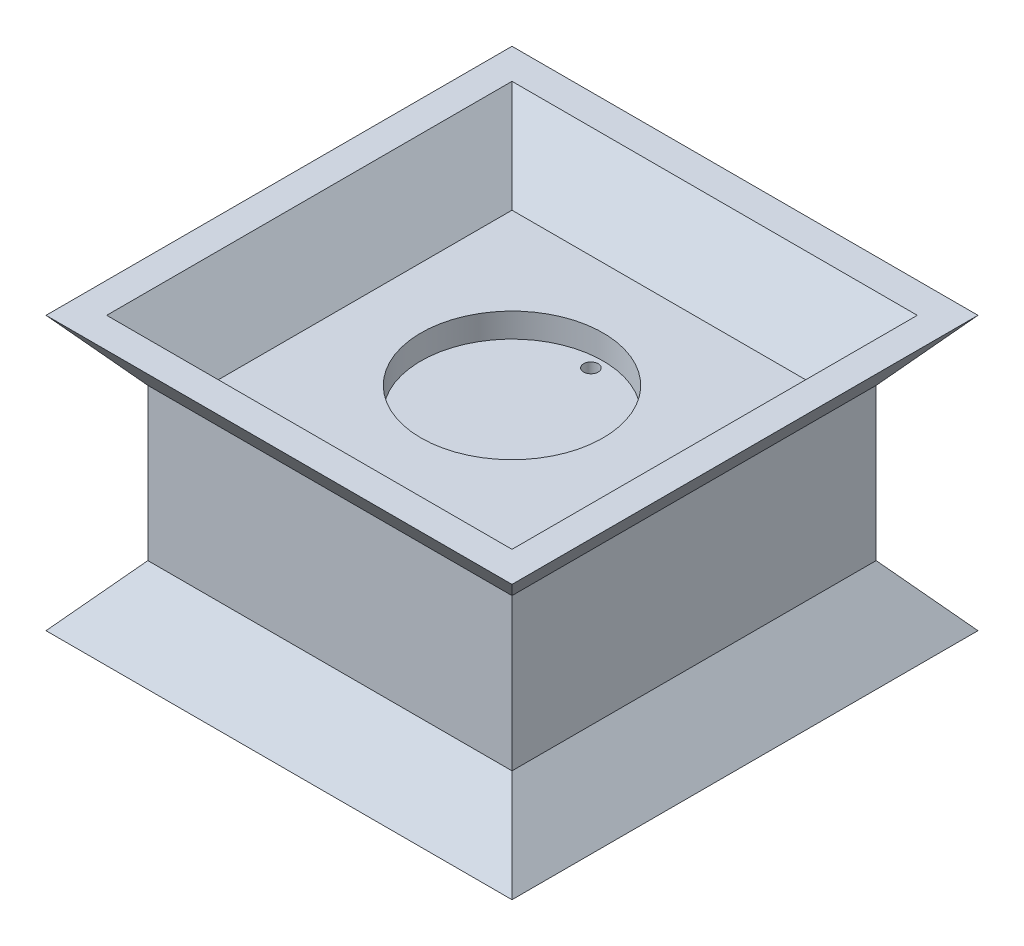
from build123d import *

# Parameters (mm, degrees)
SKETCH1_W               = 76.2
SKETCH1_H               = 76.2
BOSS_EXTRUDE1_DEPTH     = 15.875
SKETCH2_W               = 76.2
SKETCH2_H               = 76.2
BOSS_EXTRUDE2_DEPTH     = 12.7
BOSS_EXTRUDE2_DRAFT     = -40
MIRROR1_COPY_1_SKETCH_W = 76.2
MIRROR1_COPY_1_SKETCH_H = 76.2
MIRROR1_COPY_1_DEPTH    = 12.7
MIRROR1_COPY_1_DRAFT    = -40
SKETCH4_W               = 84.813130632
SKETCH4_H               = 84.813130632
CUT_EXTRUDE2_DEPTH      = 12.7
CUT_EXTRUDE2_DRAFT      = -40
SKETCH5_R               = 19.05
CUT_EXTRUDE3_DEPTH      = 5.08
SKETCH6_R               = 1.524
CUT_EXTRUDE4_DEPTH      = 20.32


with BuildPart() as part:
    # Sketch1 → Boss-Extrude1 (new, symmetric)
    with BuildSketch(Plane(origin=(0, 0, 0), x_dir=(1, 0, 0), z_dir=(0, 1, 0))):
        Rectangle(SKETCH1_W, SKETCH1_H)
    extrude(amount=BOSS_EXTRUDE1_DEPTH, both=True)


with BuildPart() as boss_extrude2_tool:
    # Sketch2 → Boss-Extrude2 (with draft: the straight prism first)
    with BuildSketch(Plane(origin=(0, 15.875, 0), x_dir=(1, 0, 0), z_dir=(0, 1, 0))):
        Rectangle(SKETCH2_W, SKETCH2_H)
    extrude(amount=BOSS_EXTRUDE2_DEPTH)
    # Boss-Extrude2: the draft: its side faces are tilted about the plane it starts from
    boss_extrude2_sides = [boss_extrude2_tool.faces().sort_by_distance(p)[0] for p in [
        (-38.1, 22.225, 0),
        (0, 22.225, 38.1),
        (38.1, 22.225, 0),
        (0, 22.225, -38.1),
    ]]
    draft(boss_extrude2_sides, Plane(origin=(0, 15.875, 0), x_dir=(1, 0, 0), z_dir=(0, 1, 0)), BOSS_EXTRUDE2_DRAFT)


with BuildPart() as part_1:
    add(part.part)

    # Boss-Extrude2: add boss_extrude2_tool
    add(boss_extrude2_tool.part)


with BuildPart() as mirror1_copy_1_tool:
    # Mirror1 copy 1 sketch → Mirror1 copy 1 (with draft: the straight prism first)
    with BuildSketch(Plane.XZ.offset(15.875)):
        Rectangle(MIRROR1_COPY_1_SKETCH_W, MIRROR1_COPY_1_SKETCH_H)
    extrude(amount=MIRROR1_COPY_1_DEPTH)
    # Mirror1 copy 1: the draft: its side faces are tilted about the plane it starts from
    mirror1_copy_1_sides = [mirror1_copy_1_tool.faces().sort_by_distance(p)[0] for p in [
        (-38.1, -22.225, 0),
        (0, -22.225, 38.1),
        (38.1, -22.225, 0),
        (0, -22.225, -38.1),
    ]]
    draft(mirror1_copy_1_sides, Plane.XZ.offset(15.875), MIRROR1_COPY_1_DRAFT)


with BuildPart() as part_2:
    add(part_1.part)

    # Mirror1 copy 1: add mirror1_copy_1_tool
    add(mirror1_copy_1_tool.part)


with BuildPart() as cut_extrude2_tool:
    # Sketch4 → Cut-Extrude2 (with draft: the straight prism first)
    with BuildSketch(Plane(origin=(0, 28.575, 0), x_dir=(1, 0, 0), z_dir=(0, 1, 0))):
        Rectangle(SKETCH4_W, SKETCH4_H)
    extrude(amount=-CUT_EXTRUDE2_DEPTH)
    # Cut-Extrude2: the draft: its side faces are tilted about the plane it starts from
    cut_extrude2_sides = [cut_extrude2_tool.faces().sort_by_distance(p)[0] for p in [
        (42.406565316, 22.225, 0),
        (0, 22.225, -42.406565316),
        (-42.406565316, 22.225, 0),
        (0, 22.225, 42.406565316),
    ]]
    draft(cut_extrude2_sides, Plane(origin=(0, 28.575, 0), x_dir=(1, 0, 0), z_dir=(0, 1, 0)), CUT_EXTRUDE2_DRAFT)


with BuildPart() as part_3:
    add(part_2.part)

    # Cut-Extrude2: cut by cut_extrude2_tool
    add(cut_extrude2_tool.part, mode=Mode.SUBTRACT)

    # Sketch5 → Cut-Extrude3 (cut)
    with BuildSketch(Plane(origin=(0, 15.875, 0), x_dir=(1, 0, 0), z_dir=(0, 1, 0))):
        with Locations(Location((0, 0, 0), (0, 0, 270))):
            Circle(SKETCH5_R)
    extrude(amount=-CUT_EXTRUDE3_DEPTH, mode=Mode.SUBTRACT)

    # Sketch6 → Cut-Extrude4 (cut)
    with BuildSketch(Plane(origin=(0, 10.795, 0), x_dir=(1, 0, 0), z_dir=(0, 1, 0))):
        with Locations(Location((0, 16.51, 0), (0, 0, 270))):
            Circle(SKETCH6_R)
    extrude(amount=-CUT_EXTRUDE4_DEPTH, mode=Mode.SUBTRACT)


solid = part_3.part
